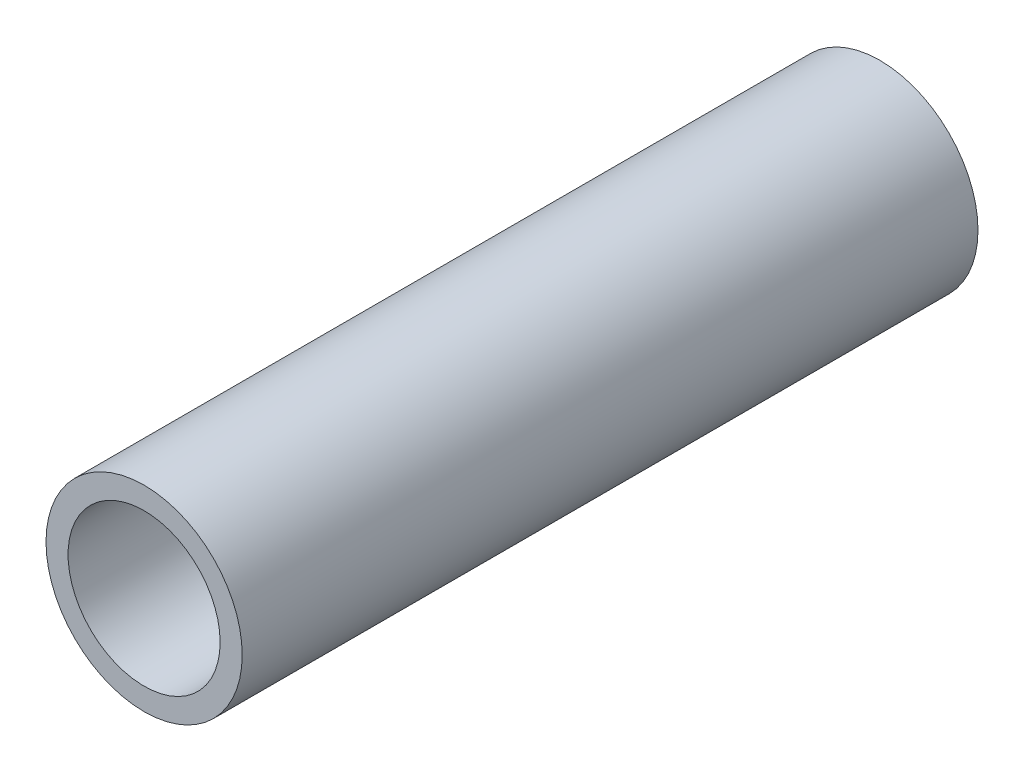
from build123d import *

# Parameters (mm, degrees)
SKETCH_1_R      = 1
SKETCH_1_R_2    = 0.775
EXTRUDE_1_DEPTH = 7.5


with BuildPart() as part:
    # Эскиз1 → Бобышка-Вытянуть1 (new body)
    with BuildSketch(Plane.XY):
        Circle(SKETCH_1_R)
        Circle(SKETCH_1_R_2, mode=Mode.SUBTRACT)
    extrude(amount=EXTRUDE_1_DEPTH)


solid = part.part
